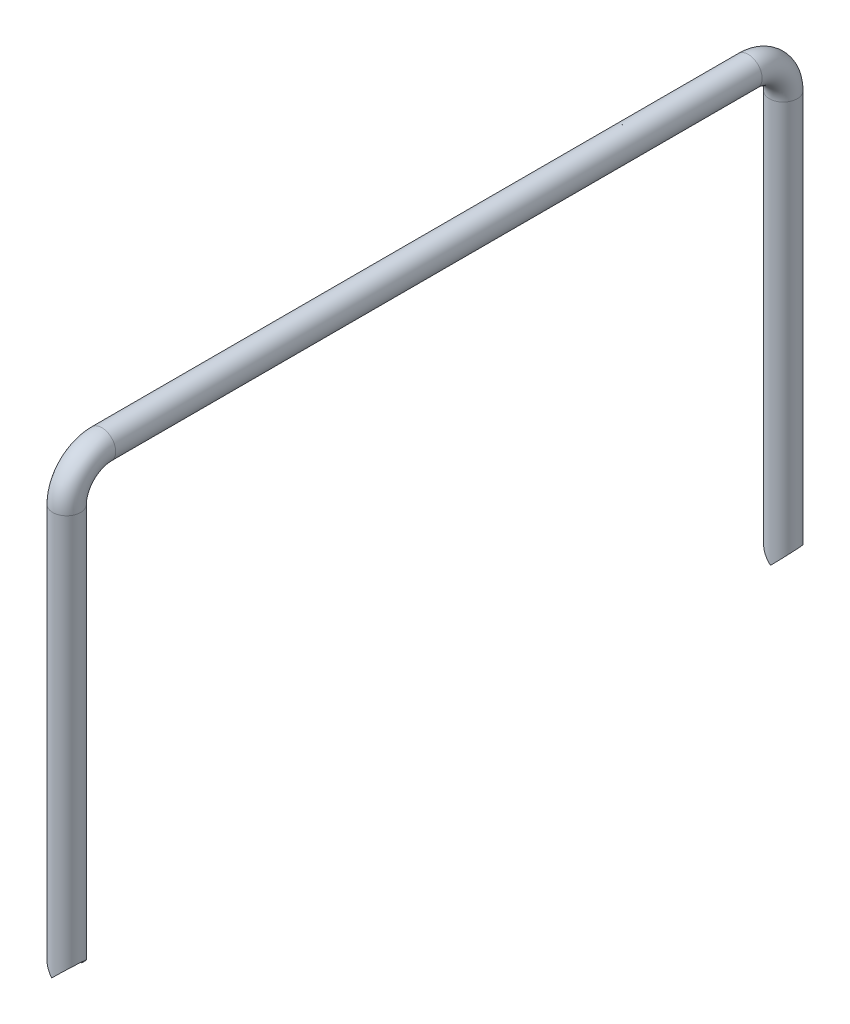
from build123d import *

# Parameters (mm, degrees)
SKETCH1_ON_SEGMENT_1_R               = 7.9375
SKETCH1_ON_SEGMENT_1_R_2             = 6.4375
PIPE_CONFIGURED_21_3_X_2_3_1_DEPTH   = 230
SKETCH1_ON_SEGMENT_2_R               = 7.9375
SKETCH1_ON_SEGMENT_2_R_2             = 6.4375
PIPE_CONFIGURED_21_3_X_2_3_1_2_ANGLE = 90
SKETCH1_ON_SEGMENT_3_R               = 7.9375
SKETCH1_ON_SEGMENT_3_R_2             = 6.4375
PIPE_CONFIGURED_21_3_X_2_3_1_3_DEPTH = 368.361654036
SKETCH1_ON_SEGMENT_4_R               = 7.9375
SKETCH1_ON_SEGMENT_4_R_2             = 6.4375
PIPE_CONFIGURED_21_3_X_2_3_1_4_ANGLE = 90
SKETCH1_R                            = 7.9375
SKETCH1_R_2                          = 6.4375
PIPE_CONFIGURED_21_3_X_2_3_1_5_DEPTH = 230
ESBO_O6_R                            = 7.9375


with BuildPart() as part:
    # Sketch1 on segment 1 (carried to segment 1) → Pipe - configured 21.3 X 2.3(1) (new body)
    with BuildSketch(Plane(origin=(58.531578249, 230, -204.180827018), x_dir=(1, 0, 0), z_dir=(0, -1, 0))):
        Circle(SKETCH1_ON_SEGMENT_1_R)
        Circle(SKETCH1_ON_SEGMENT_1_R_2, mode=Mode.SUBTRACT)
    extrude(amount=PIPE_CONFIGURED_21_3_X_2_3_1_DEPTH)


with BuildPart() as body_2:
    # Sketch1 on segment 2 (carried to the start of arc 2) → Pipe - configured 21.3 X 2.3_1 2 (revolve)
    with BuildSketch(Plane(origin=(58.531578249, 230, -204.180827018), x_dir=(1, 0, 0), z_dir=(0, 1, 0))):
        Circle(SKETCH1_ON_SEGMENT_2_R)
        Circle(SKETCH1_ON_SEGMENT_2_R_2, mode=Mode.SUBTRACT)
    revolve(axis=Axis((58.531578249, 230, -184.180827018), (1, 0, 0)), revolution_arc=PIPE_CONFIGURED_21_3_X_2_3_1_2_ANGLE)


with BuildPart() as body_3:
    # Sketch1 on segment 3 (carried to segment 3) → Pipe - configured 21.3 X 2.3_1 3 (new body)
    with BuildSketch(Plane(origin=(58.531578249, 250, -184.180827018), x_dir=(1, 0, 0), z_dir=(0, 0, 1))):
        Circle(SKETCH1_ON_SEGMENT_3_R)
        Circle(SKETCH1_ON_SEGMENT_3_R_2, mode=Mode.SUBTRACT)
    extrude(amount=PIPE_CONFIGURED_21_3_X_2_3_1_3_DEPTH)


with BuildPart() as body_4:
    # Sketch1 on segment 4 (carried to the start of arc 4) → Pipe - configured 21.3 X 2.3_1 4 (revolve)
    with BuildSketch(Plane(origin=(58.531578249, 230, 204.180827018), x_dir=(1, 0, 0), z_dir=(0, 1, 0))):
        Circle(SKETCH1_ON_SEGMENT_4_R)
        Circle(SKETCH1_ON_SEGMENT_4_R_2, mode=Mode.SUBTRACT)
    revolve(axis=Axis((58.531578249, 230, 184.180827018), (-1, 0, 0)), revolution_arc=PIPE_CONFIGURED_21_3_X_2_3_1_4_ANGLE)


with BuildPart() as body_5:
    # Sketch1 → Pipe - configured 21.3 X 2.3_1 5 (new body)
    with BuildSketch(Plane(origin=(58.531578249, 230, 204.180827018), x_dir=(1, 0, 0), z_dir=(0, -1, 0))):
        Circle(SKETCH1_R)
        Circle(SKETCH1_R_2, mode=Mode.SUBTRACT)
    extrude(amount=PIPE_CONFIGURED_21_3_X_2_3_1_5_DEPTH)


with BuildPart() as varredura_de_corte1_tool:
    # Varredura de corte1: sweep along a path in Esboço1
    with BuildLine(Plane(origin=(0, 0, 0), x_dir=(1, 0, 0), z_dir=(0, 1, 0))) as varredura_de_corte1_path:
        Line((910, 265), (37.150118, 202.653579857))
        ThreePointArc((37.150118, 202.653579857), (10.725477972, 190.013301495), (0, 162.755231864))
        Line((0, 162.755231864), (0, -162.755231864))
        ThreePointArc((0, -162.755231864), (10.725477972, -190.013301495), (37.150118, -202.653579857))
        Line((37.150118, -202.653579857), (910, -265))
    # Esboço6 → Varredura de corte1 (sweep)
    with BuildSketch(Plane.XY):
        Circle(ESBO_O6_R)
    sweep(path=varredura_de_corte1_path.line)


with BuildPart() as part_1:
    add(part.part)

    # Varredura de corte1: cut by varredura_de_corte1_tool
    add(varredura_de_corte1_tool.part, mode=Mode.SUBTRACT)


with BuildPart() as body_5_1:
    add(body_5.part)

    # Varredura de corte1: cut by varredura_de_corte1_tool
    add(varredura_de_corte1_tool.part, mode=Mode.SUBTRACT)


solid = Compound([body_2.part, body_3.part, body_4.part, part_1.part, body_5_1.part])
